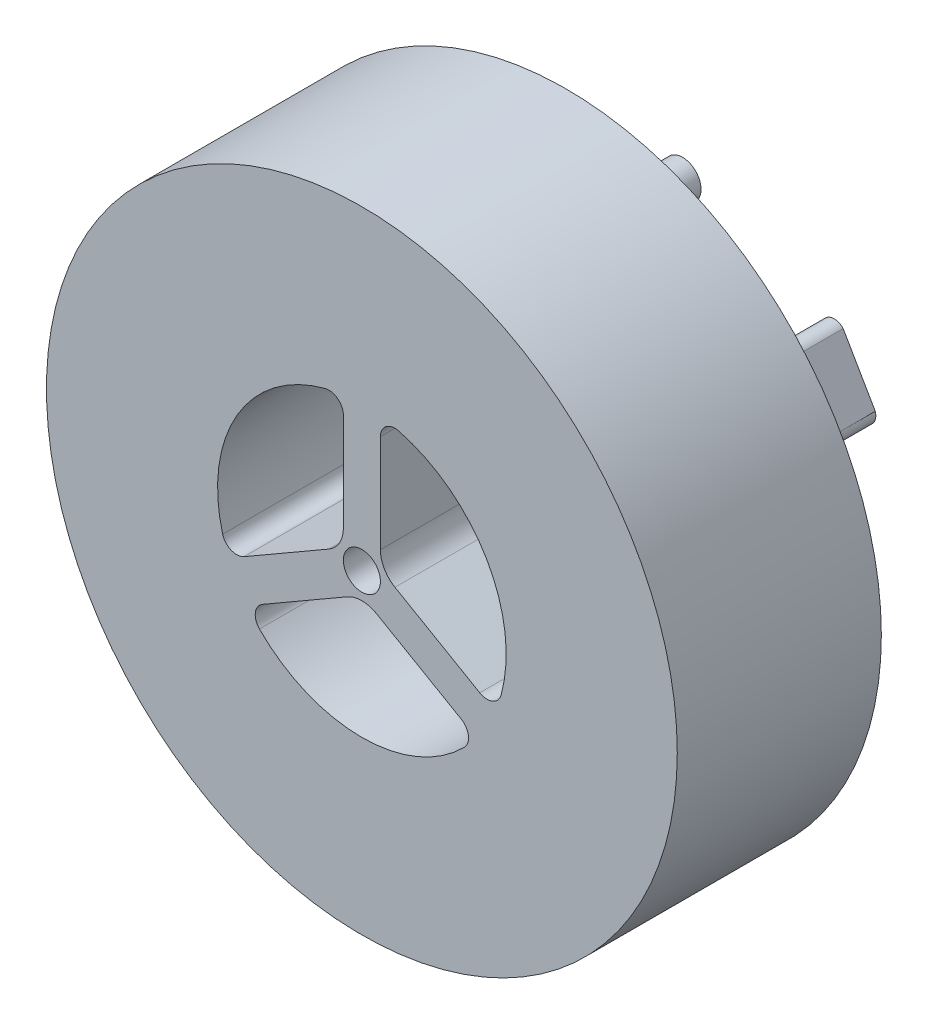
from build123d import *

# Parameters (mm, degrees)
SKETCH1_R                    = 54.1
SKETCH1_R_2                  = 3.175
BOSS_EXTRUDE1_DEPTH          = 35
BOSS_EXTRU_3_START           = -35
BOSS_EXTRU_3_DEPTH           = 20
R_P_TITION_CIRCULAIRE3_COUNT = 3
BOSS_EXTRU_4_START           = -55
ESQUISSE3_R                  = 3.175
BOSS_EXTRU_4_DEPTH           = 55
R_P_TITION_CIRCULAIRE4_COUNT = 3
ECHELLE1_SCALE               = 2


with BuildPart() as part:
    # Sketch1 → Boss-Extrude1 (new body)
    with BuildSketch(Plane.XY):
        Circle(SKETCH1_R)
        with Locations((0, 30.75)):
            Circle(SKETCH1_R_2, mode=Mode.SUBTRACT)
        with Locations((26.630281166, -15.375)):
            Circle(SKETCH1_R_2, mode=Mode.SUBTRACT)
        with Locations((-26.630281166, -15.375)):
            Circle(SKETCH1_R_2, mode=Mode.SUBTRACT)
        Circle(SKETCH1_R_2, mode=Mode.SUBTRACT)
        with BuildLine():
            Line((-3.175, 4.719838451), (-3.175, 21.514108743))
            ThreePointArc((-3.175, 21.514108743), (-4.149238079, 23.494525508), (-6.312640449, 23.931424332))
            ThreePointArc((-6.312640449, 23.931424332), (-21.434128744, 12.375), (-23.881541645, -6.498805172))
            ThreePointArc((-23.881541645, -6.498805172), (-22.421474979, -8.153917171), (-20.219264711, -8.007423714))
            Line((-20.219264711, -8.007423714), (-5.675, 0.389711432))
            ThreePointArc((-5.675, 0.389711432), (-3.844872981, 2.219838451), (-3.175, 4.719838451))
        make_face(mode=Mode.SUBTRACT)
        with BuildLine():
            Line((3.175, 4.719838451), (3.175, 21.514108743))
            ThreePointArc((3.175, 21.514108743), (4.149238079, 23.494525508), (6.312640449, 23.931424332))
            ThreePointArc((6.312640449, 23.931424332), (21.434128744, 12.375), (23.881541645, -6.498805172))
            ThreePointArc((23.881541645, -6.498805172), (22.421474979, -8.153917171), (20.219264711, -8.007423714))
            Line((20.219264711, -8.007423714), (5.675, 0.389711432))
            ThreePointArc((5.675, 0.389711432), (3.844872981, 2.219838451), (3.175, 4.719838451))
        make_face(mode=Mode.SUBTRACT)
        with BuildLine():
            Line((2.5, -5.109549882), (17.044264711, -13.506685028))
            ThreePointArc((17.044264711, -13.506685028), (18.2722369, -15.340608337), (17.568901196, -17.43261916))
            ThreePointArc((17.568901196, -17.43261916), (0, -24.75), (-17.568901196, -17.43261916))
            ThreePointArc((-17.568901196, -17.43261916), (-18.2722369, -15.340608337), (-17.044264711, -13.506685028))
            Line((-17.044264711, -13.506685028), (-2.5, -5.109549882))
            ThreePointArc((-2.5, -5.109549882), (0, -4.439676901), (2.5, -5.109549882))
        make_face(mode=Mode.SUBTRACT)
    extrude(amount=BOSS_EXTRUDE1_DEPTH)

    # Esquisse1 → Boss.-Extru.3 (add)
    with BuildSketch(Plane.XY.offset(35).offset(BOSS_EXTRU_3_START)):
        with BuildLine():
            Line((-21.394470874, 15.186776811), (-23.849369957, 10.934766872))
            ThreePointArc((-23.849369957, 10.934766872), (-25.80163538, 9.32891658), (-28.328409714, 9.4031251))
            ThreePointArc((-28.328409714, 9.4031251), (-29.704475683, 9.828675415), (-31.133898102, 10.005881992))
            ThreePointArc((-31.133898102, 10.005881992), (-32.768655428, 10.889813252), (-33.053443696, 12.726294025))
            Line((-33.053443696, 12.726294025), (-30.300729733, 17.494134468))
            Line((-30.300729733, 17.494134468), (-27.548015769, 22.261974911))
            ThreePointArc((-27.548015769, 22.261974911), (-25.815182633, 22.933581423), (-24.232297044, 21.959805679))
            ThreePointArc((-24.232297044, 21.959805679), (-23.364120437, 20.81049284), (-22.307550068, 19.831559912))
            ThreePointArc((-22.307550068, 19.831559912), (-20.979896438, 17.680413408), (-21.394470874, 15.186776811))
        make_face()
    boss_extru_3 = extrude(amount=-BOSS_EXTRU_3_DEPTH)

    # Répétition circulaire3: Boss.-Extru.3 ×3 about axis
    r_p_tition_circulaire3_axis = Axis((0, 0, 0), (0, 0, 1))
    for i in range(1, R_P_TITION_CIRCULAIRE3_COUNT):
        add(boss_extru_3.rotate(r_p_tition_circulaire3_axis, i * 360 / R_P_TITION_CIRCULAIRE3_COUNT))

    # Esquisse3 → Boss.-Extru.4 (add)
    with BuildSketch(Plane.XY.offset(35).offset(BOSS_EXTRU_4_START)):
        with Locations((0, 30.75)):
            Circle(ESQUISSE3_R)
    boss_extru_4 = extrude(amount=BOSS_EXTRU_4_DEPTH)

    # Répétition circulaire4: Boss.-Extru.4 ×3 about axis
    r_p_tition_circulaire4_axis = Axis((0, 0, 0), (0, 0, 1))
    for i in range(1, R_P_TITION_CIRCULAIRE4_COUNT):
        add(boss_extru_4.rotate(r_p_tition_circulaire4_axis, i * 360 / R_P_TITION_CIRCULAIRE4_COUNT))


with BuildPart() as part_1:
    # Echelle1: scaled about (0, 0, 16.669882878)
    add(part.part.scale(ECHELLE1_SCALE).moved(Location((0, 0, -16.669882878))))


solid = part_1.part
